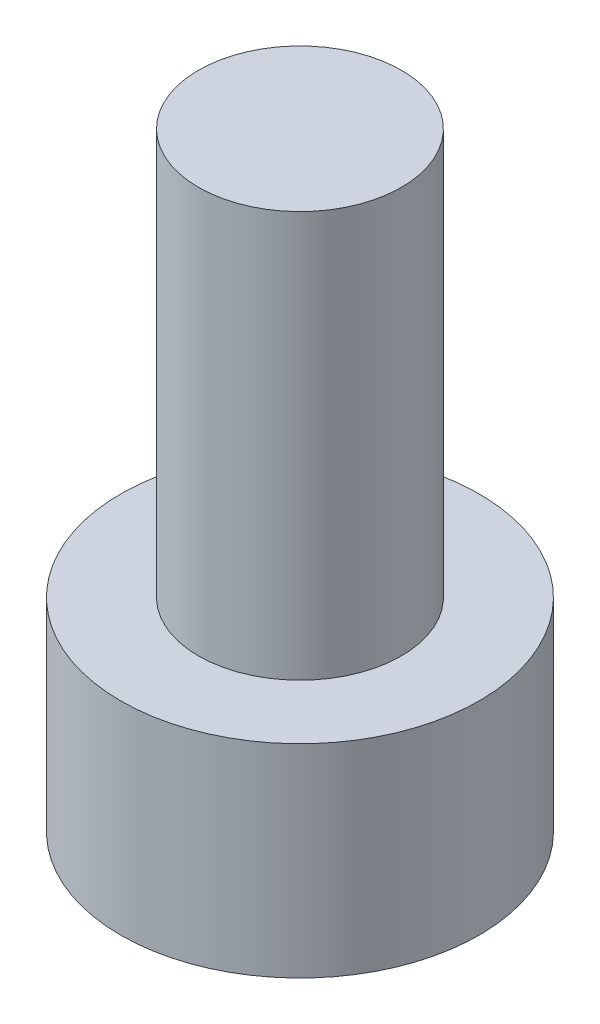
from build123d import *

# Parameters (mm, degrees)
SKETCH1_R           = 2.65
BOSS_EXTRUDE1_DEPTH = 3
SKETCH2_R           = 1.5
BOSS_EXTRUDE2_DEPTH = 6


with BuildPart() as part:
    # Sketch1 → Boss-Extrude1 (new body)
    with BuildSketch(Plane(origin=(0, 0, 0), x_dir=(1, 0, 0), z_dir=(0, 1, 0))):
        with Locations(Location((0, 0, 0), (0, 0, 270))):
            Circle(SKETCH1_R)
        Polygon((0.721687836, 1.25), (-0.721687836, 1.25), (-1.443375673, 0), (-0.721687836, -1.25), (0.721687836, -1.25), (1.443375673, 0), align=None, mode=Mode.SUBTRACT)
    extrude(amount=BOSS_EXTRUDE1_DEPTH)

    # Sketch2 → Boss-Extrude2 (add)
    with BuildSketch(Plane(origin=(0, 3, 0), x_dir=(1, 0, 0), z_dir=(0, 1, 0))):
        with Locations(Location((0, 0, 0), (0, 0, 270))):
            Circle(SKETCH2_R)
    extrude(amount=BOSS_EXTRUDE2_DEPTH)


solid = part.part
